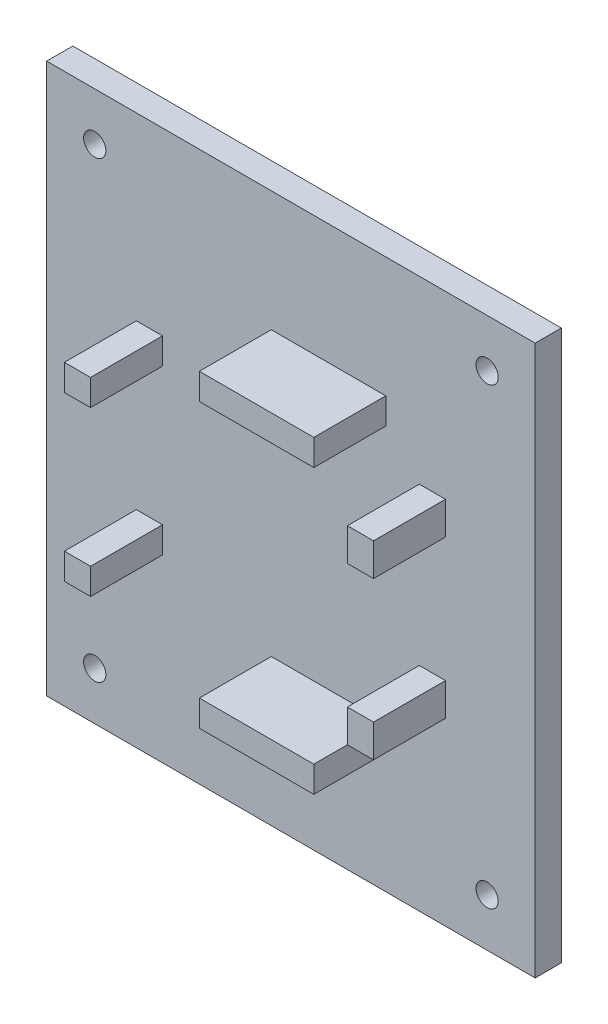
from build123d import *

# Parameters (mm, degrees)
SKETCH2_W           = 74.67
SKETCH2_H           = 84.05
SKETCH2_R           = 1.7
BOSS_EXTRUDE1_DEPTH = 4
SKETCH2_3_W         = 17.5
SKETCH2_3_H         = 4
SKETCH2_3_W_2       = 4
SKETCH2_3_H_2       = 5
BOSS_EXTRUDE2_DEPTH = 15


with BuildPart() as part:
    # Sketch2 → Boss-Extrude1 (new body)
    with BuildSketch(Plane.XY):
        Rectangle(SKETCH2_W, SKETCH2_H)
        with Locations((-29.99, -34.68)):
            Circle(SKETCH2_R, mode=Mode.SUBTRACT)
        with Locations((29.99, -34.68)):
            Circle(SKETCH2_R, mode=Mode.SUBTRACT)
        with Locations((-29.99, 34.68)):
            Circle(SKETCH2_R, mode=Mode.SUBTRACT)
        with Locations((29.99, 34.68)):
            Circle(SKETCH2_R, mode=Mode.SUBTRACT)
    extrude(amount=BOSS_EXTRUDE1_DEPTH)

    # Sketch2<3> → Boss-Extrude2 (add)
    with BuildSketch(Plane.XY):
        with Locations((5.75, -21.63)):
            Rectangle(SKETCH2_3_W, SKETCH2_3_H)
        with Locations((21.63, -12)):
            Rectangle(SKETCH2_3_W_2, SKETCH2_3_H_2)
        with Locations((-21.63, -12.5)):
            Rectangle(SKETCH2_3_W_2, SKETCH2_3_H)
        with Locations((21.63, 12)):
            Rectangle(SKETCH2_3_W_2, SKETCH2_3_H_2)
        with Locations((-21.63, 12.5)):
            Rectangle(SKETCH2_3_W_2, SKETCH2_3_H)
        with Locations((5.75, 21.63)):
            Rectangle(SKETCH2_3_W, SKETCH2_3_H)
    extrude(amount=BOSS_EXTRUDE2_DEPTH)


solid = part.part
